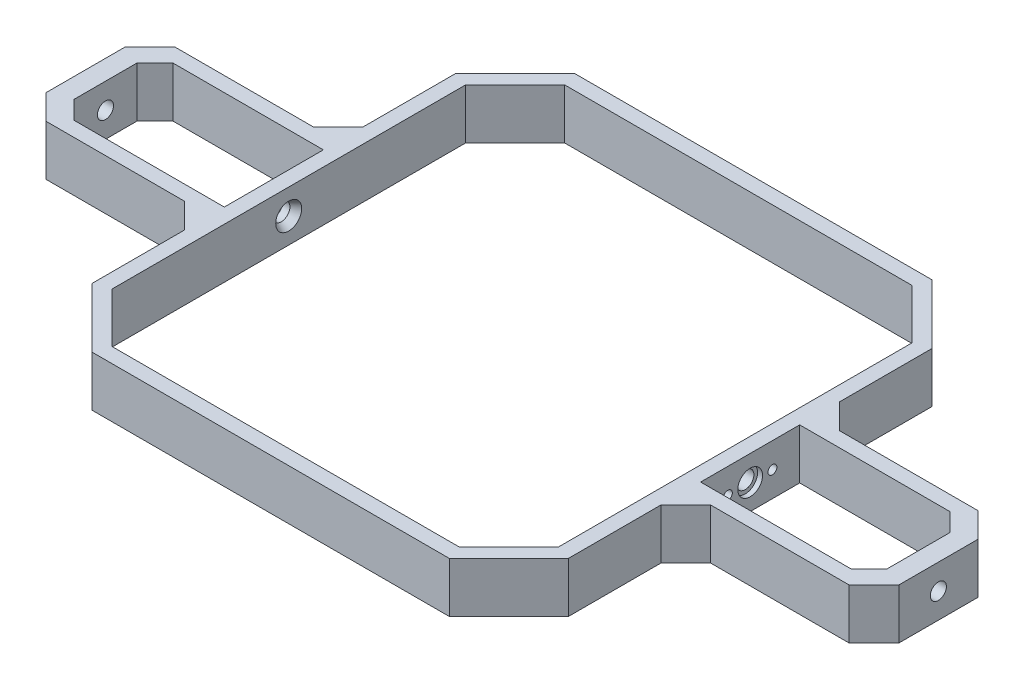
from build123d import *

# Parameters (mm, degrees)
BOSS_EXTRUDE1_DEPTH      = 5.08
BOSS_EXTRUDE1_DEPTH_BACK = 5.08
SKETCH2_W                = 96.17
SKETCH2_H                = 97.44
SKETCH2_W_2              = 90.17
SKETCH2_H_2              = 91.44
SKETCH3_R                = 1.75
CUT_EXTRUDE1_DEPTH       = 108.926427255
SKETCH4_R                = 1.75
CUT_EXTRUDE2_DEPTH       = 1
SKETCH5_R                = 0.9
CUT_EXTRUDE3_DEPTH       = 107.148168613
SKETCH6_R                = 2.5
CUT_EXTRUDE4_DEPTH       = 1
BOSS_EXTRUDE2_DEPTH      = 10.16
CHAMFER1_SIZE            = 1.5
CHAMFER1_SIZE2           = 0.866025404
SKETCH9_R                = 1.625
CUT_EXTRUDE5_DEPTH       = 5
CHAMFER3_SIZE            = 10
CHAMFER4_SIZE            = 12
CHAMFER5_SIZE            = 5
CUT_EXTRUDE6_DEPTH       = 100.435864883


with BuildPart() as part:
    # Sketch2 → Boss-Extrude1 (new, two sides: drawn at the far end of the back side and taken through both)
    with BuildSketch(Plane(origin=(0, 0, 0), x_dir=(1, 0, 0), z_dir=(0, 1, 0)).offset(-BOSS_EXTRUDE1_DEPTH_BACK)):
        Rectangle(SKETCH2_W, SKETCH2_H)
        Rectangle(SKETCH2_W_2, SKETCH2_H_2, mode=Mode.SUBTRACT)
    extrude(amount=BOSS_EXTRUDE1_DEPTH + BOSS_EXTRUDE1_DEPTH_BACK)

    # Sketch3 → Cut-Extrude1 (cut, through all)
    with BuildSketch(Plane(origin=(48.085, 0, 0), x_dir=(0, 0, -1), z_dir=(1, 0, 0))):
        Circle(SKETCH3_R)
    extrude(amount=-CUT_EXTRUDE1_DEPTH, mode=Mode.SUBTRACT)

    # Sketch4 → Cut-Extrude2 (cut)
    with BuildSketch(Plane.ZY.offset(-45.085)):
        with Locations((-4.5, 0)):
            Circle(SKETCH4_R)
        with Locations(Location((4.5, 0, 0), (0, 0, 180))):
            Circle(SKETCH4_R)
    extrude(amount=-CUT_EXTRUDE2_DEPTH, mode=Mode.SUBTRACT)

    # Sketch5 → Cut-Extrude3 (cut, through all)
    with BuildSketch(Plane.ZY.offset(-46.085)):
        with Locations((-4.5, 0)):
            Circle(SKETCH5_R)
        with Locations(Location((4.5, 0, 0), (0, 0, 180))):
            Circle(SKETCH5_R)
    extrude(amount=-CUT_EXTRUDE3_DEPTH, mode=Mode.SUBTRACT)

    # Sketch6 → Cut-Extrude4 (cut)
    with BuildSketch(Plane(origin=(48.085, 0, 0), x_dir=(0, 0, -1), z_dir=(1, 0, 0))):
        Circle(SKETCH6_R)
    extrude(amount=-CUT_EXTRUDE4_DEPTH, mode=Mode.SUBTRACT)

    # Sketch8 → Boss-Extrude2 (add)
    with BuildSketch(Plane(origin=(0, 5.08, 0), x_dir=(1, 0, 0), z_dir=(0, 1, 0))):
        Polygon((48.085, -13), (86.085, -13), (86.085, 13), (48.085, 13), (48.085, 10), (78.085, 10), (78.085, -10), (48.085, -10), align=None)
        Polygon((-86.085, 13), (-86.085, -13), (-48.085, -13), (-48.085, -10), (-78.085, -10), (-78.085, 10), (-48.085, 10), (-48.085, 13), align=None)
    extrude(amount=-BOSS_EXTRUDE2_DEPTH)

    # Chamfer1
    chamfer1_edges = [part.edges().sort_by_distance(p)[0] for p in [
        (-45.085, 0, 1.75),
    ]]
    chamfer1_side = [part.faces().sort_by_distance(p)[0] for p in [
        (-46.585, 0, 1.75),
    ]]
    chamfer(chamfer1_edges, length=CHAMFER1_SIZE, length2=CHAMFER1_SIZE2, reference=chamfer1_side[0])

    # Sketch9 → Cut-Extrude5 (cut)
    with BuildSketch(Plane.ZY.offset(86.085)):
        Circle(SKETCH9_R)
    cut_extrude5 = extrude(amount=-CUT_EXTRUDE5_DEPTH, mode=Mode.SUBTRACT)

    # Mirror2: Cut-Extrude5 across plane
    add(cut_extrude5.mirror(Plane(origin=(0, 0, 0), x_dir=(0, 0, 1), z_dir=(1, 0, 0))), mode=Mode.SUBTRACT)

    # Chamfer3
    chamfer3_edges = [part.edges().sort_by_distance(p)[0] for p in [
        (45.085, 0, -45.72),
        (45.085, 0, 45.72),
        (-45.085, 0, 45.72),
        (-45.085, 0, -45.72),
    ]]
    chamfer(chamfer3_edges, length=CHAMFER3_SIZE)

    # Chamfer4
    chamfer4_edges = [part.edges().sort_by_distance(p)[0] for p in [
        (-48.085, 0, -48.72),
        (48.085, 0, -48.72),
        (48.085, 0, 48.72),
        (-48.085, 0, 48.72),
    ]]
    chamfer(chamfer4_edges, length=CHAMFER4_SIZE)

    # Chamfer5
    chamfer5_edges = [part.edges().sort_by_distance(p)[0] for p in [
        (86.085, 0, 13),
        (48.085, 0, 13),
        (48.085, 0, -13),
        (86.085, 0, -13),
        (-86.085, 0, 13),
        (-48.085, 0, 13),
        (-48.085, 0, -13),
        (-86.085, 0, -13),
    ]]
    chamfer(chamfer5_edges, length=CHAMFER5_SIZE)

    # Sketch10 → Cut-Extrude6 (cut, through all)
    with BuildSketch(Plane(origin=(0, 5.08, 0), x_dir=(1, 0, 0), z_dir=(0, 1, 0))):
        Polygon((78.085, 10), (78.085, -10), (78.428145751, -10), (82.085, -6.343145751), (82.085, 6.343145751), (78.428145751, 10), align=None)
        Polygon((-82.085, -6.343145751), (-78.428145751, -10), (-78.085, -10), (-78.085, 10), (-78.428145751, 10), (-82.085, 6.343145751), align=None)
    extrude(amount=-CUT_EXTRUDE6_DEPTH, mode=Mode.SUBTRACT)


solid = part.part
